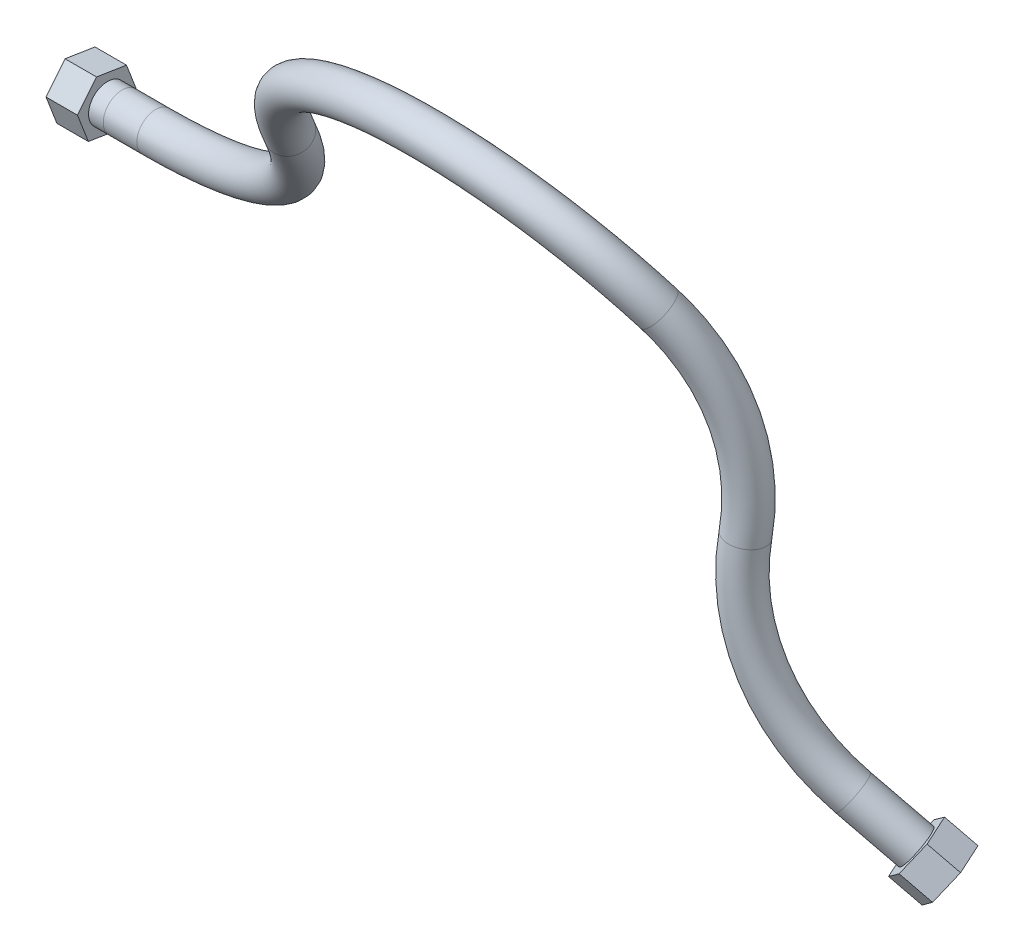
from build123d import *

# Parameters (mm, degrees)
SWEEP_THIN1_PROFILE_R   = 11.43
SWEEP_THIN1_PROFILE_R_2 = 6.35
SKETCH18_R              = 8.89
BOSS_EXTRUDE1_DEPTH     = 19.05
SKETCH19_R              = 8.89
BOSS_EXTRUDE2_DEPTH     = 19.05


with BuildPart() as part:
    # Sweep-Thin1: sweep along a curve in space
    with BuildLine() as sweep_thin1_path:
        Line((487.205434409, -90.375419218, 45.123748712), (512.750023236, -112.454113118, 32.276286161))
        ThreePointArc((440.132159767, 30.133830628, 63.108518255), (449.876081908, -36.741029626, 62.374861715), (487.205434409, -90.375419218, 45.123748712))
        ThreePointArc((407.06752472, 141.408837524, 82.28497359), (433.942607147, 90.249287025, 64.545891369), (440.132159767, 30.133830628, 63.108518255))
        ThreePointArc((157.006811309, 95.802614022, 55.746979486), (264.850579743, 189.003665844, 109.98012518), (407.06752472, 141.408837524, 82.28497359))
        ThreePointArc((20.32, 0, 0), (108.310270713, 26.960595243, 15.688212324), (157.006811309, 95.802614022, 55.746979486))
        Line((0, 0, 0), (20.32, 0, 0))
        Line((0, 0, 0), (-8.89, 0, 0))
    # Sweep-Thin1 profile (on start of the path) → Sweep-Thin1 (sweep)
    with BuildSketch(Plane(origin=(-8.89, 0, 0), x_dir=(0, 0, 1), z_dir=(1, 0, 0))):
        Circle(SWEEP_THIN1_PROFILE_R)
        Circle(SWEEP_THIN1_PROFILE_R_2, mode=Mode.SUBTRACT)
    sweep(path=sweep_thin1_path.line)


with BuildPart() as body_2:
    # Sketch18 → Boss-Extrude1 (new body)
    with BuildSketch(Plane(origin=(296.856609846, -256.579045583, -149.30184251), x_dir=(-0.35563414046032077, -0.7420848977366932, 0.5681851482485005), z_dir=(0.7071067811865456, -0.611166391532659, -0.35563414046032127))):
        Polygon((-62.231137267, -306.369616201), (-71.396572791, -290.494616201), (-89.727443837, -290.494616201), (-98.892879361, -306.369616201), (-89.727443837, -322.244616201), (-71.396572791, -322.244616201), align=None)
        with Locations(Location((-80.562008314, -306.369616201, 0), (0, 0, 217.439856523))):
            Circle(SKETCH18_R, mode=Mode.SUBTRACT)
    extrude(amount=BOSS_EXTRUDE1_DEPTH)


with BuildPart() as body_3:
    # Sketch19 → Boss-Extrude2 (new body)
    with BuildSketch(Plane(origin=(-8.89, 0, 0), x_dir=(0, 0.7778388802300997, -0.6284637431088484), z_dir=(-1, 0, 0))):
        Polygon((18.330871047, 0), (9.165435523, 15.875), (-9.165435523, 15.875), (-18.330871047, 0), (-9.165435523, -15.875), (9.165435523, -15.875), align=None)
        with Locations(Location((0, 0, 0), (0, 0, 321.063128984))):
            Circle(SKETCH19_R, mode=Mode.SUBTRACT)
    extrude(amount=BOSS_EXTRUDE2_DEPTH)


solid = Compound([part.part, body_2.part, body_3.part])
